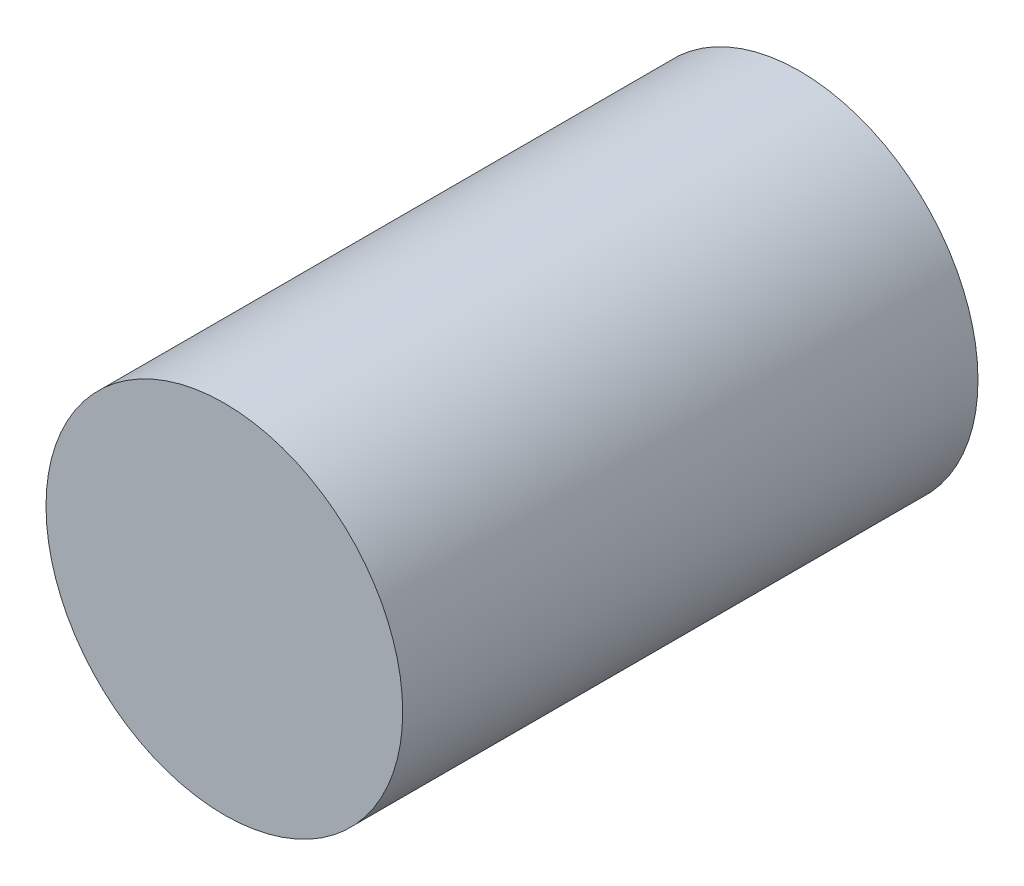
from build123d import *

# Parameters (mm, degrees)
SKETCH1_R           = 15.5
BOSS_EXTRUDE1_DEPTH = 50


with BuildPart() as part:
    # Sketch1 → Boss-Extrude1 (new body)
    with BuildSketch(Plane.XY):
        Circle(SKETCH1_R)
    extrude(amount=BOSS_EXTRUDE1_DEPTH)


solid = part.part
